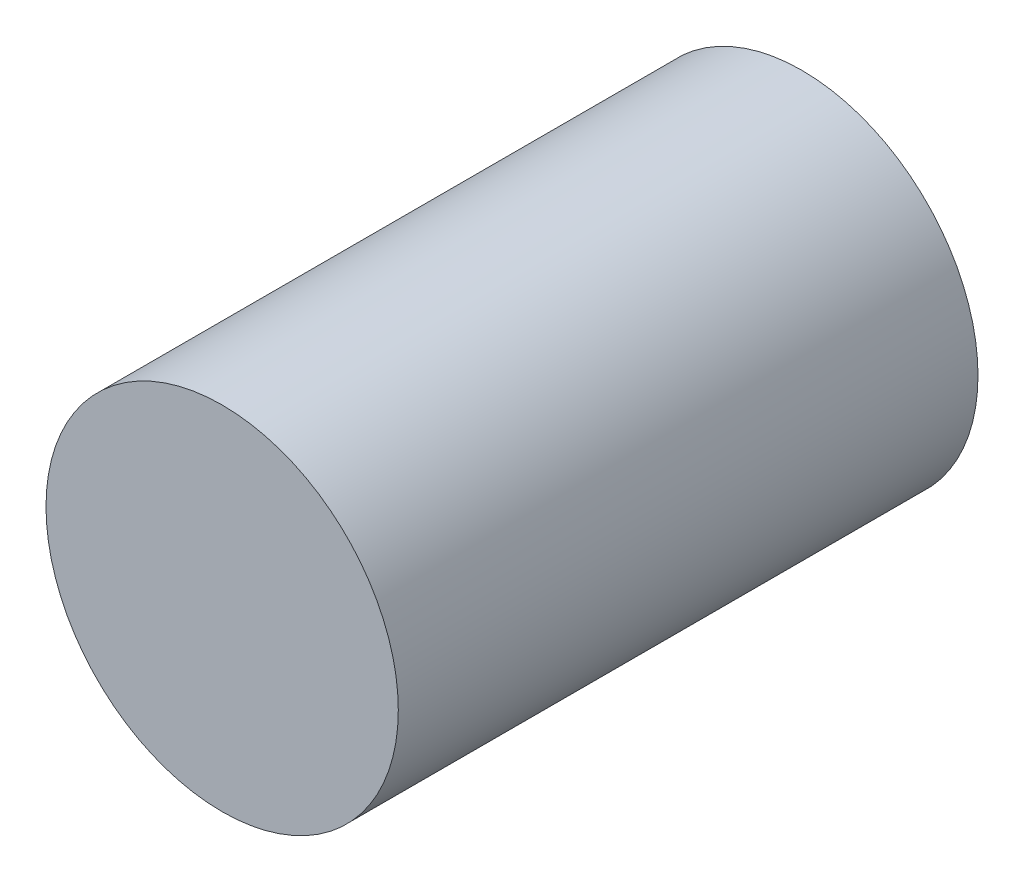
from build123d import *

# Parameters (mm, degrees)
SKETCH1_R           = 11
BOSS_EXTRUDE1_DEPTH = 36.2


with BuildPart() as part:
    # Sketch1 → Boss-Extrude1 (new body)
    with BuildSketch(Plane.XY):
        with Locations(Location((0, 0, 0), (0, 0, 180))):
            Circle(SKETCH1_R)
    extrude(amount=BOSS_EXTRUDE1_DEPTH)


solid = part.part
